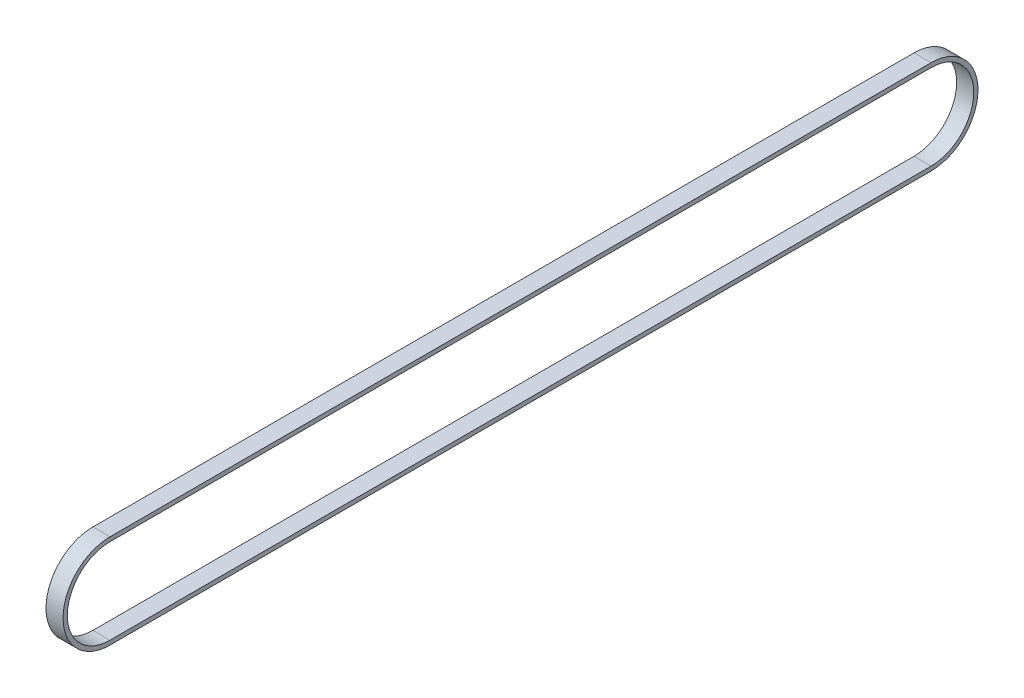
from build123d import *

# Parameters (mm, degrees)
EXTRUDE_1_DEPTH = 4


with BuildPart() as part:
    # 草图1 → 拉伸-薄壁1 (new, symmetric)
    with BuildSketch(Plane(origin=(0, 0, 0), x_dir=(0, 0, -1), z_dir=(1, 0, 0))):
        with BuildLine():
            Line((192.5, -22), (-192.5, -22))
            ThreePointArc((-192.5, -22), (-214.5, 0), (-192.5, 22))
            Line((-192.5, 22), (192.5, 22))
            ThreePointArc((192.5, 22), (214.5, 0), (192.5, -22))
        make_face()
        with BuildLine():
            Line((192.5, -20), (-192.5, -20))
            ThreePointArc((-192.5, -20), (-212.5, 0), (-192.5, 20))
            Line((-192.5, 20), (192.5, 20))
            ThreePointArc((192.5, 20), (212.5, 0), (192.5, -20))
        make_face(mode=Mode.SUBTRACT)
    extrude(amount=EXTRUDE_1_DEPTH, both=True)


solid = part.part
